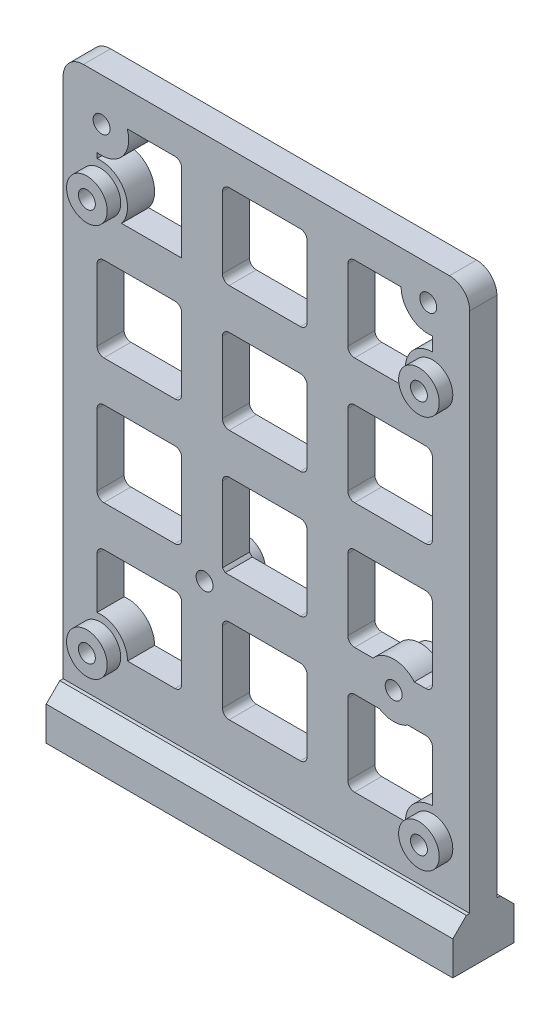
from build123d import *

# Parameters (mm, degrees)
SKETCH1_W           = 60
SKETCH1_H           = 80
BOSS_EXTRUDE1_DEPTH = 4
SKETCH2_R           = 1.25
CUT_EXTRUDE1_DEPTH  = 51.159744816
BOSS_EXTRUDE2_START = 2
SKETCH3_R           = 3
SKETCH3_R_2         = 1.25
BOSS_EXTRUDE2_DEPTH = 2
SKETCH4_R           = 1.25
CUT_EXTRUDE2_DEPTH  = 51.358713248
BOSS_EXTRUDE3_START = 2
SKETCH5_R           = 3
SKETCH5_R_2         = 1.25
BOSS_EXTRUDE3_DEPTH = 2
SKETCH7_W           = 12.5
SKETCH7_H           = 12.5
CUT_EXTRUDE4_DEPTH  = 4
FILLET3_R           = 1
FILLET2_R           = 3
SKETCH8_W           = 60
SKETCH8_H           = 9
BOSS_EXTRUDE4_DEPTH = 7
CHAMFER1_SIZE       = 2
SKETCH9_R           = 1.45
CUT_EXTRUDE5_DEPTH  = 8


with BuildPart() as part:
    # Sketch1 → Boss-Extrude1 (new body)
    with BuildSketch(Plane.XY):
        Rectangle(SKETCH1_W, SKETCH1_H)
    extrude(amount=BOSS_EXTRUDE1_DEPTH)

    # Sketch2 → Cut-Extrude1 (cut, through all)
    with BuildSketch(Plane.XY.offset(4)):
        with Locations((-24.5, 25)):
            Circle(SKETCH2_R)
        with Locations(Location((24.5, 25, 0), (0, 0, 180))):
            Circle(SKETCH2_R)
        with Locations((24.5, -33)):
            Circle(SKETCH2_R)
        with Locations(Location((-24.5, -33, 0), (0, 0, 180))):
            Circle(SKETCH2_R)
    extrude(amount=-CUT_EXTRUDE1_DEPTH, mode=Mode.SUBTRACT)

    # Sketch3 → Boss-Extrude2 (add)
    # profile 1 of 4: a face of its own
    with BuildSketch(Plane.XY.offset(4).offset(BOSS_EXTRUDE2_START)):
        with Locations((-24.5, 25)):
            Circle(SKETCH3_R)
        with Locations((-24.5, 25)):
            Circle(SKETCH3_R_2, mode=Mode.SUBTRACT)
    # profile 2 of 4: a face of its own
    with BuildSketch(Plane.XY.offset(4).offset(BOSS_EXTRUDE2_START)):
        with Locations((24.5, 25)):
            Circle(SKETCH3_R)
        with Locations((24.5, 25)):
            Circle(SKETCH3_R_2, mode=Mode.SUBTRACT)
    # profile 3 of 4: a face of its own
    with BuildSketch(Plane.XY.offset(4).offset(BOSS_EXTRUDE2_START)):
        with Locations((24.5, -33)):
            Circle(SKETCH3_R)
        with Locations((24.5, -33)):
            Circle(SKETCH3_R_2, mode=Mode.SUBTRACT)
    # profile 4 of 4: a face of its own
    with BuildSketch(Plane.XY.offset(4).offset(BOSS_EXTRUDE2_START)):
        with Locations((-24.5, -33)):
            Circle(SKETCH3_R)
        with Locations((-24.5, -33)):
            Circle(SKETCH3_R_2, mode=Mode.SUBTRACT)
    extrude(amount=-BOSS_EXTRUDE2_DEPTH)

    # Sketch4 → Cut-Extrude2 (cut, through all)
    with BuildSketch(Plane(origin=(0, 0, 0), x_dir=(-1, 0, 0), z_dir=(0, 0, -1))):
        with Locations((-18.772703202, -17.1)):
            Circle(SKETCH4_R)
        with Locations((9.127296798, -17.1)):
            Circle(SKETCH4_R)
        with Locations((-23.872703202, 35)):
            Circle(SKETCH4_R)
        with Locations((24.327296798, 33.7)):
            Circle(SKETCH4_R)
    extrude(amount=-CUT_EXTRUDE2_DEPTH, mode=Mode.SUBTRACT)

    # Sketch5 → Boss-Extrude3 (add)
    # profile 1 of 4: a face of its own
    with BuildSketch(Plane(origin=(0, 0, 0), x_dir=(-1, 0, 0), z_dir=(0, 0, -1)).offset(BOSS_EXTRUDE3_START)):
        with Locations(Location((-23.872703202, 35, 0), (0, 0, 180))):
            Circle(SKETCH5_R)
        with Locations((-23.872703202, 35)):
            Circle(SKETCH5_R_2, mode=Mode.SUBTRACT)
    # profile 2 of 4: a face of its own
    with BuildSketch(Plane(origin=(0, 0, 0), x_dir=(-1, 0, 0), z_dir=(0, 0, -1)).offset(BOSS_EXTRUDE3_START)):
        with Locations(Location((24.327296798, 33.7, 0), (0, 0, 180))):
            Circle(SKETCH5_R)
        with Locations((24.327296798, 33.7)):
            Circle(SKETCH5_R_2, mode=Mode.SUBTRACT)
    # profile 3 of 4: a face of its own
    with BuildSketch(Plane(origin=(0, 0, 0), x_dir=(-1, 0, 0), z_dir=(0, 0, -1)).offset(BOSS_EXTRUDE3_START)):
        with Locations(Location((9.127296798, -17.1, 0), (0, 0, 180))):
            Circle(SKETCH5_R)
        with Locations((9.127296798, -17.1)):
            Circle(SKETCH5_R_2, mode=Mode.SUBTRACT)
    # profile 4 of 4: a face of its own
    with BuildSketch(Plane(origin=(0, 0, 0), x_dir=(-1, 0, 0), z_dir=(0, 0, -1)).offset(BOSS_EXTRUDE3_START)):
        with Locations(Location((-18.772703202, -17.1, 0), (0, 0, 180))):
            Circle(SKETCH5_R)
        with Locations((-18.772703202, -17.1)):
            Circle(SKETCH5_R_2, mode=Mode.SUBTRACT)
    extrude(amount=-BOSS_EXTRUDE3_DEPTH)

    # Sketch7 → Cut-Extrude4 (cut)
    with BuildSketch(Plane.XY.offset(4)):
        with BuildLine():
            Line((-12.5, 35), (-20.544440734, 35))
            ThreePointArc((-20.544440734, 35), (-21.279248479, 31.109748768), (-25, 29.756971925))
            Line((-25, 29.756971925), (-25, 28.968626967))
            ThreePointArc((-25, 28.968626967), (-21.009991553, 26.954441363), (-21.377501001, 22.5))
            Line((-21.377501001, 22.5), (-12.5, 22.5))
            Line((-12.5, 22.5), (-12.5, 35))
        make_face()
        with Locations((-0.25, 28.75)):
            Rectangle(SKETCH7_W, SKETCH7_H)
        with BuildLine():
            Line((19.872703202, 35), (12, 35))
            Line((12, 35), (12, 22.5))
            Line((12, 22.5), (21.377501001, 22.5))
            ThreePointArc((21.377501001, 22.5), (20.894448725, 26.732050808), (24.5, 29))
            Line((24.5, 29), (24.5, 31.049493864))
            ThreePointArc((24.5, 31.049493864), (21.275511179, 31.957863646), (19.872703202, 35))
        make_face()
        with Locations((-0.25, 10.25)):
            Rectangle(SKETCH7_W, SKETCH7_H)
        with Locations((18.25, 10.25)):
            Rectangle(SKETCH7_W, SKETCH7_H)
        with BuildLine():
            Line((6, -2), (-6.5, -2))
            Line((-6.5, -2), (-6.5, -14.083825016))
            ThreePointArc((-6.5, -14.083825016), (-6.286149505, -14.284350509), (-6.087559968, -14.5))
            Line((-6.087559968, -14.5), (6, -14.5))
            Line((6, -14.5), (6, -2))
        make_face()
        with BuildLine():
            Line((24.5, -2), (12, -2))
            Line((12, -2), (12, -14.5))
            Line((12, -14.5), (15.732966371, -14.5))
            ThreePointArc((15.732966371, -14.5), (18.772703202, -13.1), (21.812440032, -14.5))
            Line((21.812440032, -14.5), (24.5, -14.5))
            Line((24.5, -14.5), (24.5, -2))
        make_face()
        with BuildLine():
            ThreePointArc((20.879833952, -20.5), (18.772703202, -21.1), (16.665572451, -20.5))
            Line((16.665572451, -20.5), (12, -20.5))
            Line((12, -20.5), (12, -33))
            Line((12, -33), (20.5, -33))
            ThreePointArc((20.5, -33), (21.671572875, -30.171572875), (24.5, -29))
            Line((24.5, -29), (24.5, -20.5))
            Line((24.5, -20.5), (20.879833952, -20.5))
        make_face()
        with Locations((-0.25, -26.75)):
            Rectangle(SKETCH7_W, SKETCH7_H)
        with Locations((-18.75, 10.25)):
            Rectangle(SKETCH7_W, SKETCH7_H)
        with Locations((-18.75, -8.25)):
            Rectangle(SKETCH7_W, SKETCH7_H)
        with BuildLine():
            Line((-12.5, -20.5), (-25, -20.5))
            Line((-25, -20.5), (-25, -29.031373033))
            ThreePointArc((-25, -29.031373033), (-21.854248689, -30), (-20.5, -33))
            Line((-20.5, -33), (-12.5, -33))
            Line((-12.5, -33), (-12.5, -20.5))
        make_face()
    extrude(amount=-CUT_EXTRUDE4_DEPTH, mode=Mode.SUBTRACT)

    # Fillet3
    fillet3_edges = [part.edges().sort_by_distance(p)[0] for p in [
        (12, 22.5, 2),
        (12, 35, 2),
        (-6.5, 22.5, 2),
        (-6.5, 35, 2),
        (6, 35, 2),
        (6, 22.5, 2),
        (-12.5, 35, 2),
        (-6.5, -33, 2),
        (-6.5, -20.5, 2),
        (6, -20.5, 2),
        (6, -33, 2),
        (12, -33, 2),
        (12, -20.5, 2),
        (24.5, -20.5, 2),
        (12, -14.5, 2),
        (12, -2, 2),
        (24.5, -2, 2),
        (24.5, -14.5, 2),
        (-6.5, -2, 2),
        (6, -2, 2),
        (6, -14.5, 2),
        (-25, -14.5, 2),
        (-25, -2, 2),
        (-12.5, -2, 2),
        (-12.5, -14.5, 2),
        (-25, 4, 2),
        (-25, 16.5, 2),
        (-12.5, 16.5, 2),
        (-12.5, 4, 2),
        (-6.5, 4, 2),
        (-6.5, 16.5, 2),
        (6, 16.5, 2),
        (6, 4, 2),
        (12, 4, 2),
        (12, 16.5, 2),
        (24.5, 16.5, 2),
        (24.5, 4, 2),
        (-25, -20.5, 2),
        (-12.5, -20.5, 2),
        (-12.5, -33, 2),
    ]]
    fillet(fillet3_edges, radius=FILLET3_R)

    # Fillet2
    fillet2_edges = [part.edges().sort_by_distance(p)[0] for p in [
        (-30, 40, 2),
        (30, 40, 2),
    ]]
    fillet(fillet2_edges, radius=FILLET2_R)

    # Sketch8 → Boss-Extrude4 (add)
    with BuildSketch(Plane.XZ.offset(40)):
        with Locations((0, 2)):
            Rectangle(SKETCH8_W, SKETCH8_H)
    extrude(amount=BOSS_EXTRUDE4_DEPTH)

    # Chamfer1
    chamfer1_edges = [part.edges().sort_by_distance(p)[0] for p in [
        (0, -40, -2.5),
        (0, -40, 6.5),
    ]]
    chamfer(chamfer1_edges, length=CHAMFER1_SIZE)

    # Sketch9 → Cut-Extrude5 (cut)
    with BuildSketch(Plane.XZ.offset(47)):
        with Locations(Location((-22.5, 2, 0), (0, 0, 270))):
            Circle(SKETCH9_R)
        with Locations(Location((22.5, 2, 0), (0, 0, 90))):
            Circle(SKETCH9_R)
    extrude(amount=-CUT_EXTRUDE5_DEPTH, mode=Mode.SUBTRACT)


solid = part.part
